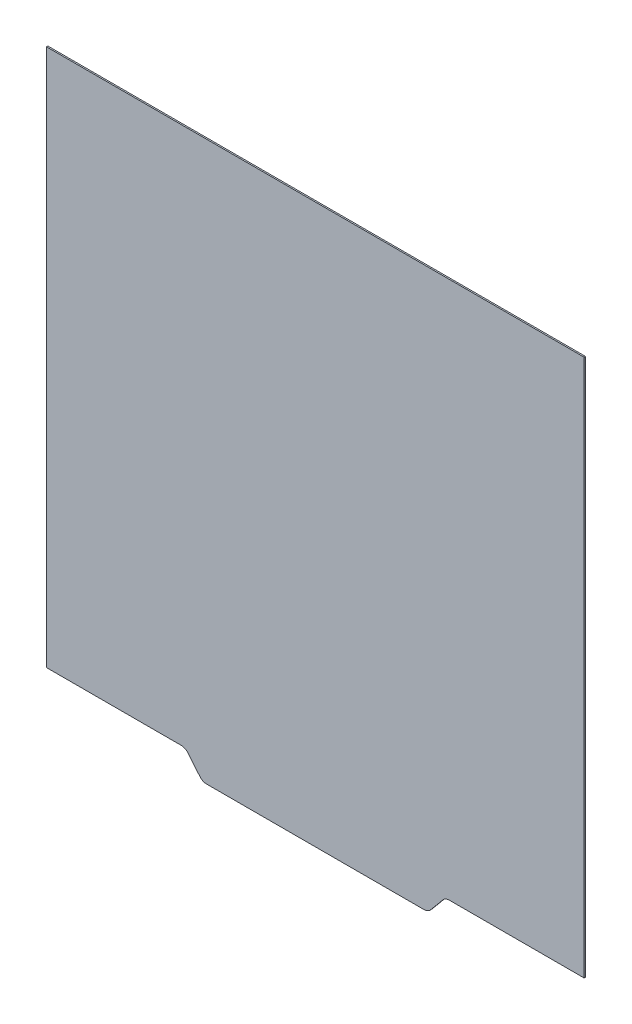
from build123d import *

# Parameters (mm, degrees)
SKETCH_1_W          = 310
SKETCH_1_H          = 310
SKETCH_1_W_2        = 150
SKETCH_1_H_2        = 12
EXTRUDE_1_DEPTH     = 0.8
CUT_EXTRUDE_1_DEPTH = 0.8
FILLET_1_R          = 5


with BuildPart() as part:
    # 草图1 → 凸台-拉伸1 (new body)
    with BuildSketch(Plane.XY):
        with Locations((-24.087837838, -4.538288288)):
            Rectangle(SKETCH_1_W, SKETCH_1_H)
        with Locations((-24.087837838, -165.538288288)):
            Rectangle(SKETCH_1_W_2, SKETCH_1_H_2)
    extrude(amount=EXTRUDE_1_DEPTH)

    # 草图2 → 切除-拉伸1 (cut)
    with BuildSketch(Plane(origin=(0, 0, 0), x_dir=(-1, 0, 0), z_dir=(0, 0, -1))):
        Polygon((99.087837838, -159.538288288), (89.087837838, -171.538288288), (99.087837838, -171.538288288), align=None)
        Polygon((-50.912162162, -159.538288288), (-40.912162162, -171.538288288), (-50.912162162, -171.538288288), align=None)
    extrude(amount=-CUT_EXTRUDE_1_DEPTH, mode=Mode.SUBTRACT)

    # 圆角1
    fillet_1_edges = [part.edges().sort_by_distance(p)[0] for p in [
        (50.912162162, -159.538288288, 0.4),
        (-99.087837838, -159.538288288, 0.4),
        (-89.087837838, -171.538288288, 0.4),
        (40.912162162, -171.538288288, 0.4),
    ]]
    fillet(fillet_1_edges, radius=FILLET_1_R)


solid = part.part
